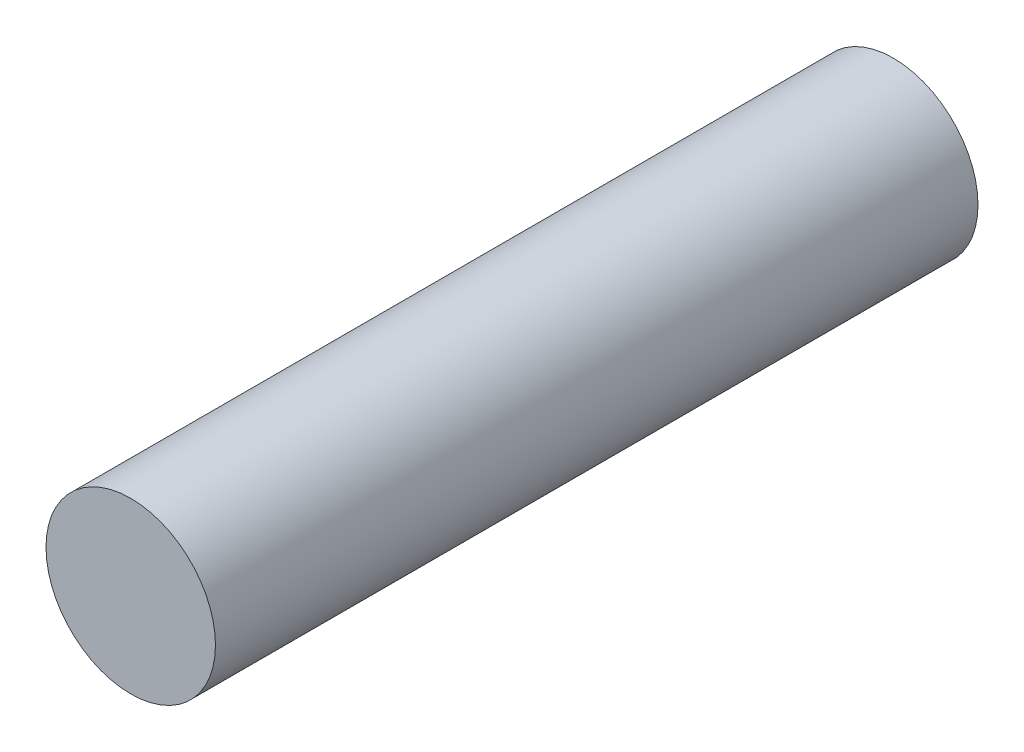
from build123d import *

# Parameters (mm, degrees)
SKETCH1_R           = 1
BOSS_EXTRUDE1_DEPTH = 4.5


with BuildPart() as part:
    # Sketch1 → Boss-Extrude1 (new, symmetric)
    with BuildSketch(Plane.XY):
        Circle(SKETCH1_R)
    extrude(amount=BOSS_EXTRUDE1_DEPTH, both=True)


solid = part.part
